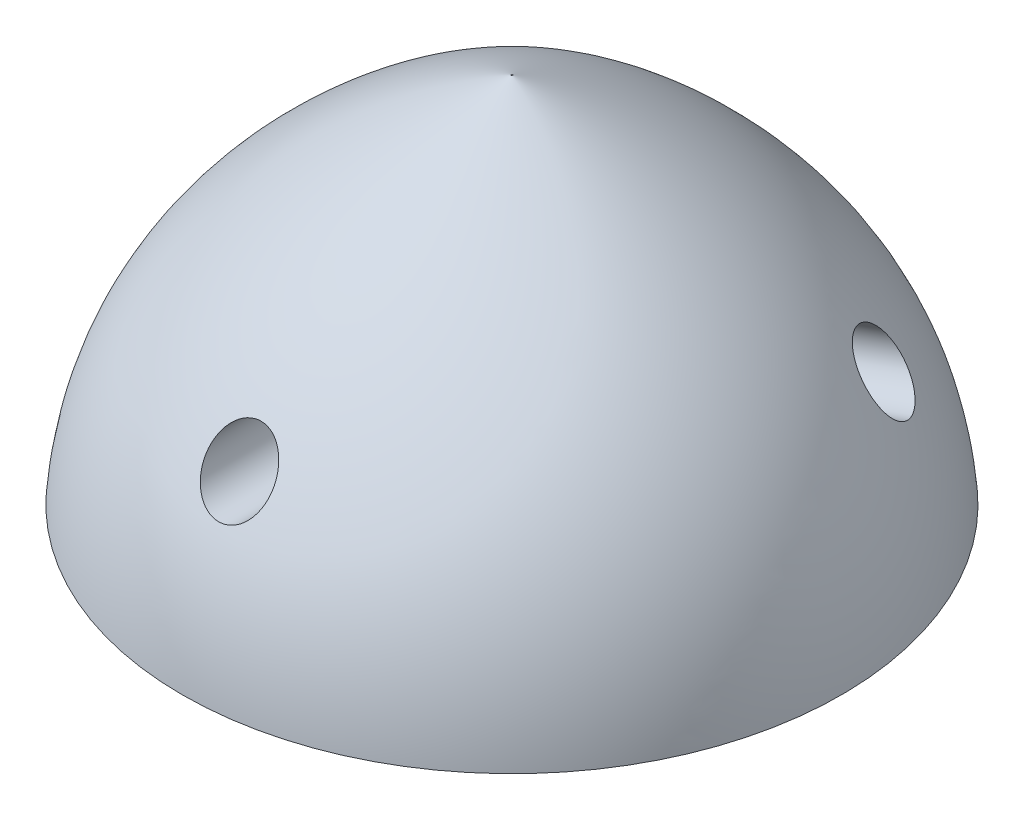
from build123d import *

# Parameters (mm, degrees)
SKETCH2_R          = 800
CUT_EXTRUDE1_DEPTH = 5333.333333333
CIRPATTERN1_COUNT  = 3


with BuildPart() as part:
    # Sketch1 → Revolve1 (revolve)
    with BuildSketch(Plane.XY, mode=Mode.PRIVATE) as revolve1_sk:
        with BuildLine():
            Line((0, 0), (8000, 0))
            add(Edge.make_bspline(
                [(13.110887759, 9028.633574294), (7529.852626364, 5849.053131887), (8000, 0)],
                knots=[0, 0, 0, 0.656149397, 0.656149397, 0.656149397], degree=2))
            Line((13.110887759, 9028.633574294), (0, 9000))
            Line((0, 9000), (0, 0))
        make_face()
    revolve(revolve1_sk.sketch.rotate(Axis((0, 52.187321795, 0), (0, -1, 0)), 90), axis=Axis((0, 52.187321795, 0), (0, -1, 0)))

    # Sketch2 → Cut-Extrude1 (cut)
    with BuildSketch(Plane.XY.offset(8000)):
        with Locations((0, 4000)):
            Circle(SKETCH2_R)
    cut_extrude1 = extrude(amount=-CUT_EXTRUDE1_DEPTH, mode=Mode.SUBTRACT)

    # CirPattern1: Cut-Extrude1 ×3 about axis
    cirpattern1_axis = Axis((0, 0, 0), (0, 1, 0))
    for i in range(1, CIRPATTERN1_COUNT):
        add(cut_extrude1.rotate(cirpattern1_axis, i * 360 / CIRPATTERN1_COUNT), mode=Mode.SUBTRACT)


solid = part.part
